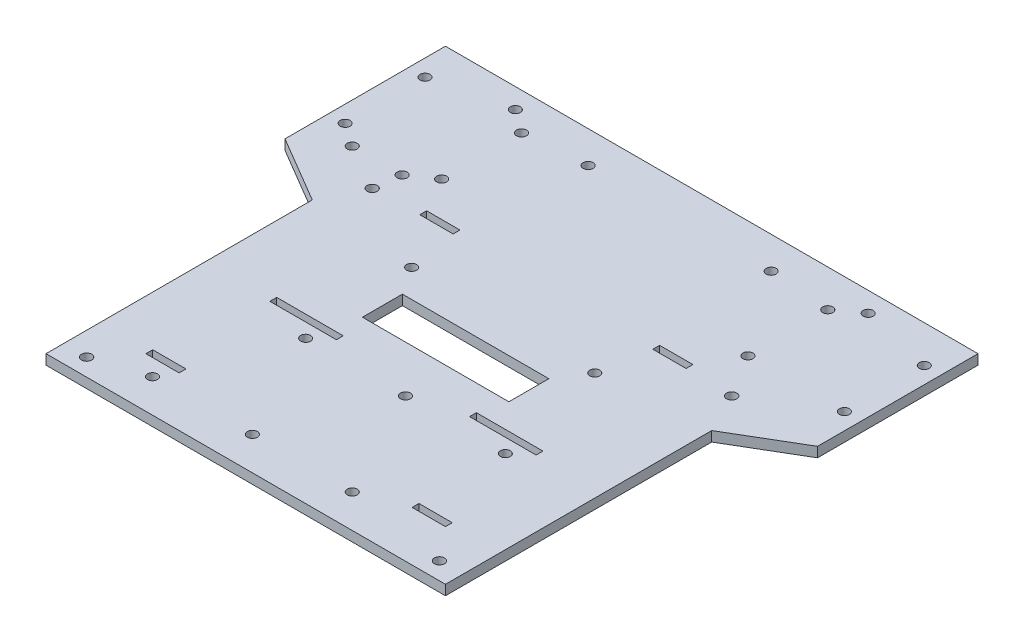
from build123d import *

# Parameters (mm, degrees)
BOSS_EXTRUDE1_DEPTH = 3
SKETCH2_R           = 1.5
CUT_EXTRUDE1_DEPTH  = 107.343782141
SKETCH3_2_R         = 1.5
CUT_EXTRUDE3_DEPTH  = 107.343782141
SKETCH4_R           = 1.5
CUT_EXTRUDE4_DEPTH  = 107.343782141
SKETCH5_R           = 1.5
CUT_EXTRUDE5_DEPTH  = 3
SKETCH6_R           = 1.525
SKETCH6_W           = 10
SKETCH6_H           = 2.05
SKETCH6_W_2         = 20
CUT_EXTRUDE7_DEPTH  = 107.343782141
SKETCH9_R           = 1.525
CUT_EXTRUDE8_DEPTH  = 3
SKETCH10_W          = 44
SKETCH10_H          = 12
CUT_EXTRUDE9_DEPTH  = 5
SKETCH11_R          = 1.5
CUT_EXTRUDE10_DEPTH = 5


with BuildPart() as part:
    # Sketch1 → Boss-Extrude1 (new body)
    with BuildSketch(Plane(origin=(0, 0, 0), x_dir=(1, 0, 0), z_dir=(0, 1, 0))):
        Polygon((-80, 70), (-80, 21.791828604), (-60, 10), (-60, -70), (60, -70), (60, 10), (80, 21.791828604), (80, 70), align=None)
    extrude(amount=BOSS_EXTRUDE1_DEPTH)

    # Sketch2 → Cut-Extrude1 (cut, through all)
    with BuildSketch(Plane(origin=(0, 3, 0), x_dir=(1, 0, 0), z_dir=(0, 1, 0))):
        with Locations((-38, -60)):
            Circle(SKETCH2_R)
        with Locations((-25, -27)):
            Circle(SKETCH2_R)
        with Locations((5, -27)):
            Circle(SKETCH2_R)
        with Locations((-8, -60)):
            Circle(SKETCH2_R)
        with Locations((35, -27)):
            Circle(SKETCH2_R)
        with Locations((22, -60)):
            Circle(SKETCH2_R)
    extrude(amount=-CUT_EXTRUDE1_DEPTH, mode=Mode.SUBTRACT)

    # Sketch3<2> → Cut-Extrude3 (cut, through all)
    with BuildSketch(Plane(origin=(0, 3, 0), x_dir=(1, 0, 0), z_dir=(0, 1, 0))):
        with Locations((-27.529579069, 60.385555627)):
            Circle(SKETCH3_2_R)
        with Locations((-27.529579069, 7.385555627)):
            Circle(SKETCH3_2_R)
        with Locations((27.470420931, 7.385555627)):
            Circle(SKETCH3_2_R)
        with Locations((27.470420931, 60.385555627)):
            Circle(SKETCH3_2_R)
    extrude(amount=-CUT_EXTRUDE3_DEPTH, mode=Mode.SUBTRACT)

    # Sketch4 → Cut-Extrude4 (cut, through all)
    with BuildSketch(Plane(origin=(0, 3, 0), x_dir=(1, 0, 0), z_dir=(0, 1, 0))):
        with Locations((-75, 34.863883517)):
            Circle(SKETCH4_R)
        with Locations((-75, 58.863883517)):
            Circle(SKETCH4_R)
        with Locations((-46, 34.863883517)):
            Circle(SKETCH4_R)
        with Locations((-46, 58.863883517)):
            Circle(SKETCH4_R)
        with Locations((46, 58.863883517)):
            Circle(SKETCH4_R)
        with Locations((46, 34.863883517)):
            Circle(SKETCH4_R)
        with Locations((75, 34.863883517)):
            Circle(SKETCH4_R)
        with Locations((75, 58.863883517)):
            Circle(SKETCH4_R)
    extrude(amount=-CUT_EXTRUDE4_DEPTH, mode=Mode.SUBTRACT)

    # Sketch5 → Cut-Extrude5 (cut)
    with BuildSketch(Plane(origin=(0, 3, 0), x_dir=(1, 0, 0), z_dir=(0, 1, 0))):
        with Locations((-68, 30)):
            Circle(SKETCH5_R)
        with Locations((-53, 30)):
            Circle(SKETCH5_R)
    extrude(amount=-CUT_EXTRUDE5_DEPTH, mode=Mode.SUBTRACT)

    # Sketch6 → Cut-Extrude7 (cut, through all)
    with BuildSketch(Plane(origin=(0, 3, 0), x_dir=(1, 0, 0), z_dir=(0, 1, 0))):
        with Locations((-53, -64.8)):
            Circle(SKETCH6_R)
        with Locations((53, -64.8)):
            Circle(SKETCH6_R)
        with Locations((-40, -53.975)):
            Rectangle(SKETCH6_W, SKETCH6_H)
        with Locations((40, -53.975)):
            Rectangle(SKETCH6_W, SKETCH6_H)
        with Locations((30, -21.725)):
            Rectangle(SKETCH6_W_2, SKETCH6_H)
        with Locations((-30, -21.725)):
            Rectangle(SKETCH6_W_2, SKETCH6_H)
        with Locations((35, 23.325)):
            Rectangle(SKETCH6_W, SKETCH6_H)
        with Locations((-35, 23.325)):
            Rectangle(SKETCH6_W, SKETCH6_H)
    extrude(amount=-CUT_EXTRUDE7_DEPTH, mode=Mode.SUBTRACT)

    # Sketch9 → Cut-Extrude8 (cut)
    with BuildSketch(Plane(origin=(0, 3, 0), x_dir=(1, 0, 0), z_dir=(0, 1, 0))):
        with Locations((-54, 22)):
            Circle(SKETCH9_R)
        with Locations((54, 22)):
            Circle(SKETCH9_R)
    extrude(amount=-CUT_EXTRUDE8_DEPTH, mode=Mode.SUBTRACT)

    # Sketch10 → Cut-Extrude9 (cut)
    with BuildSketch(Plane(origin=(0, 3, 0), x_dir=(1, 0, 0), z_dir=(0, 1, 0))):
        with Locations((0.046472237, -6.975074484)):
            Rectangle(SKETCH10_W, SKETCH10_H)
    extrude(amount=-CUT_EXTRUDE9_DEPTH, mode=Mode.SUBTRACT)

    # Sketch11 → Cut-Extrude10 (cut)
    with BuildSketch(Plane(origin=(0, 3, 0), x_dir=(1, 0, 0), z_dir=(0, 1, 0))):
        with Locations((-53, 64)):
            Circle(SKETCH11_R)
        with Locations((53, 64)):
            Circle(SKETCH11_R)
    extrude(amount=-CUT_EXTRUDE10_DEPTH, mode=Mode.SUBTRACT)


solid = part.part
